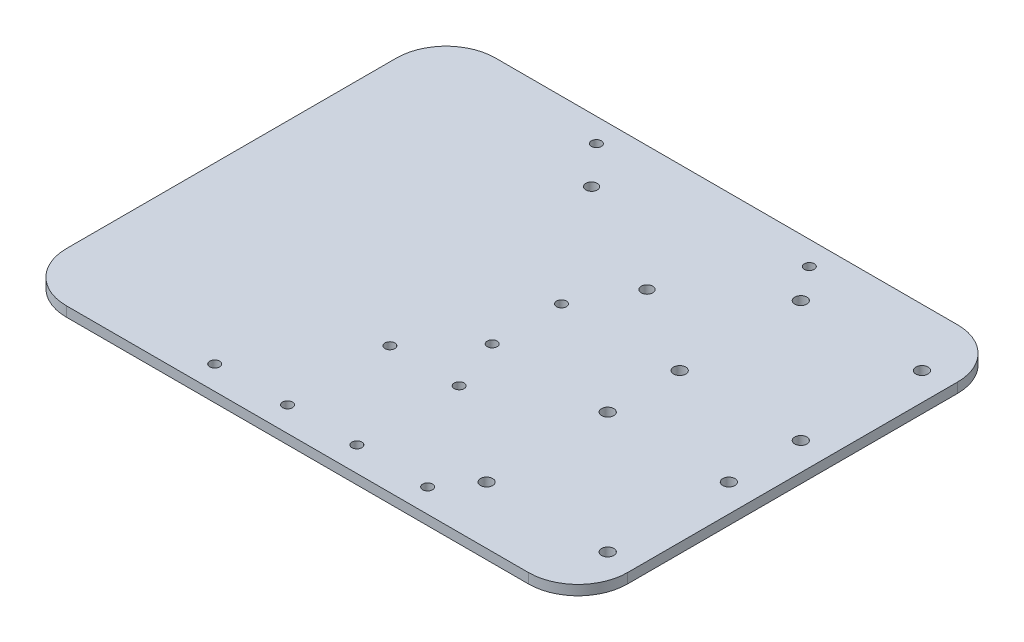
from build123d import *

# Parameters (mm, degrees)
SKETCH2_W           = 170
SKETCH2_H           = 130
BOSS_EXTRUDE1_DEPTH = 3
SKETCH3_R           = 1.5
CUT_EXTRUDE1_DEPTH  = 108.046718773
SKETCH4_R           = 1.75
SKETCH4_R_2         = 1.5
SKETCH4_R_3         = 1.85
CUT_EXTRUDE2_DEPTH  = 108.046718773
FILLET1_R           = 15


with BuildPart() as part:
    # Sketch2 → Boss-Extrude1 (new body)
    with BuildSketch(Plane(origin=(0, 0, 0), x_dir=(1, 0, 0), z_dir=(0, 1, 0))):
        Rectangle(SKETCH2_W, SKETCH2_H)
    extrude(amount=BOSS_EXTRUDE1_DEPTH)

    # Sketch3 → Cut-Extrude1 (cut, through all)
    with BuildSketch(Plane.XZ):
        with Locations((32.25, 57.816706978)):
            Circle(SKETCH3_R)
        with Locations((-32.25, -57.816706978)):
            Circle(SKETCH3_R)
        with Locations((-32.25, 57.816706978)):
            Circle(SKETCH3_R)
        with Locations((32.25, -57.816706978)):
            Circle(SKETCH3_R)
    extrude(amount=-CUT_EXTRUDE1_DEPTH, mode=Mode.SUBTRACT)

    # Sketch4 → Cut-Extrude2 (cut, through all)
    with BuildSketch(Plane(origin=(0, 3, 0), x_dir=(1, 0, 0), z_dir=(0, 1, 0))):
        with Locations((13.7, 27.2)):
            Circle(SKETCH4_R)
        with Locations((-21.7, 45.8)):
            Circle(SKETCH4_R)
        with Locations((-10.5, -26.5)):
            Circle(SKETCH4_R_2)
        with Locations((10.5, -26.5)):
            Circle(SKETCH4_R_2)
        with Locations((10.5, -57.5)):
            Circle(SKETCH4_R_2)
        with Locations((-10.5, -57.5)):
            Circle(SKETCH4_R_2)
        with Locations((76.6, -10.9)):
            Circle(SKETCH4_R_3)
        with Locations((76.6, -47.6)):
            Circle(SKETCH4_R_3)
        with Locations((39.9, -47.6)):
            Circle(SKETCH4_R_3)
        with Locations((39.9, -10.9)):
            Circle(SKETCH4_R_3)
        with Locations((39.9, 47.6)):
            Circle(SKETCH4_R_3)
        with Locations((76.6, 47.6)):
            Circle(SKETCH4_R_3)
        with Locations((76.6, 10.9)):
            Circle(SKETCH4_R_3)
        with Locations((39.9, 10.9)):
            Circle(SKETCH4_R_3)
        with Locations((4.5, -10.5)):
            Circle(SKETCH4_R_2)
        with Locations((4.5, 10.5)):
            Circle(SKETCH4_R_2)
    extrude(amount=-CUT_EXTRUDE2_DEPTH, mode=Mode.SUBTRACT)

    # Fillet1
    fillet1_edges = [part.edges().sort_by_distance(p)[0] for p in [
        (-85, 1.5, 65),
        (85, 1.5, 65),
        (85, 1.5, -65),
        (-85, 1.5, -65),
    ]]
    fillet(fillet1_edges, radius=FILLET1_R)


solid = part.part
